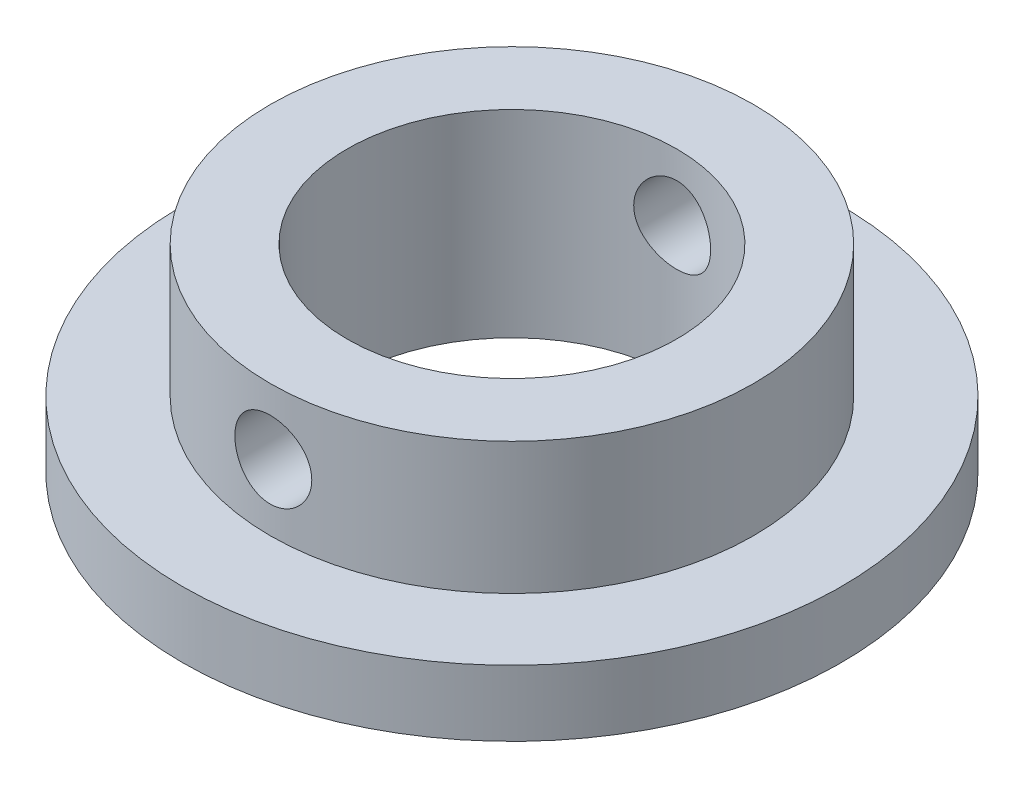
from build123d import *

# Parameters (mm, degrees)
SKETCH1_R               = 15
SKETCH1_R_2             = 7.5
BOSS_EXTRUDE1_DEPTH     = 3
SKETCH2_R               = 11
SKETCH2_R_2             = 7.5
BOSS_EXTRUDE2_DEPTH     = 6
CUT_EXTRUDE1_DEPTH      = 24.043437244
CUT_EXTRUDE1_DEPTH_BACK = 24.043437244
SKETCH3_R               = 1.75


with BuildPart() as part:
    # Sketch1 → Boss-Extrude1 (new body)
    with BuildSketch(Plane(origin=(0, 0, 0), x_dir=(1, 0, 0), z_dir=(0, 1, 0))):
        with Locations(Location((0, 0, 0), (0, 0, 270))):
            Circle(SKETCH1_R)
        with Locations(Location((0, 0, 0), (0, 0, 270))):
            Circle(SKETCH1_R_2, mode=Mode.SUBTRACT)
    extrude(amount=BOSS_EXTRUDE1_DEPTH)

    # Sketch2 → Boss-Extrude2 (add)
    with BuildSketch(Plane(origin=(0, 3, 0), x_dir=(1, 0, 0), z_dir=(0, 1, 0))):
        with Locations(Location((0, 0, 0), (0, 0, 270))):
            Circle(SKETCH2_R)
        with Locations(Location((0, 0, 0), (0, 0, 270))):
            Circle(SKETCH2_R_2, mode=Mode.SUBTRACT)
    extrude(amount=BOSS_EXTRUDE2_DEPTH)

    # Sketch3 → Cut-Extrude1 (cut, two sides: drawn at the far end of the back side and taken through both)
    with BuildSketch(Plane.XY.offset(-CUT_EXTRUDE1_DEPTH_BACK)):
        with Locations((0, 6)):
            Circle(SKETCH3_R)
    extrude(amount=CUT_EXTRUDE1_DEPTH + CUT_EXTRUDE1_DEPTH_BACK, mode=Mode.SUBTRACT)


solid = part.part
